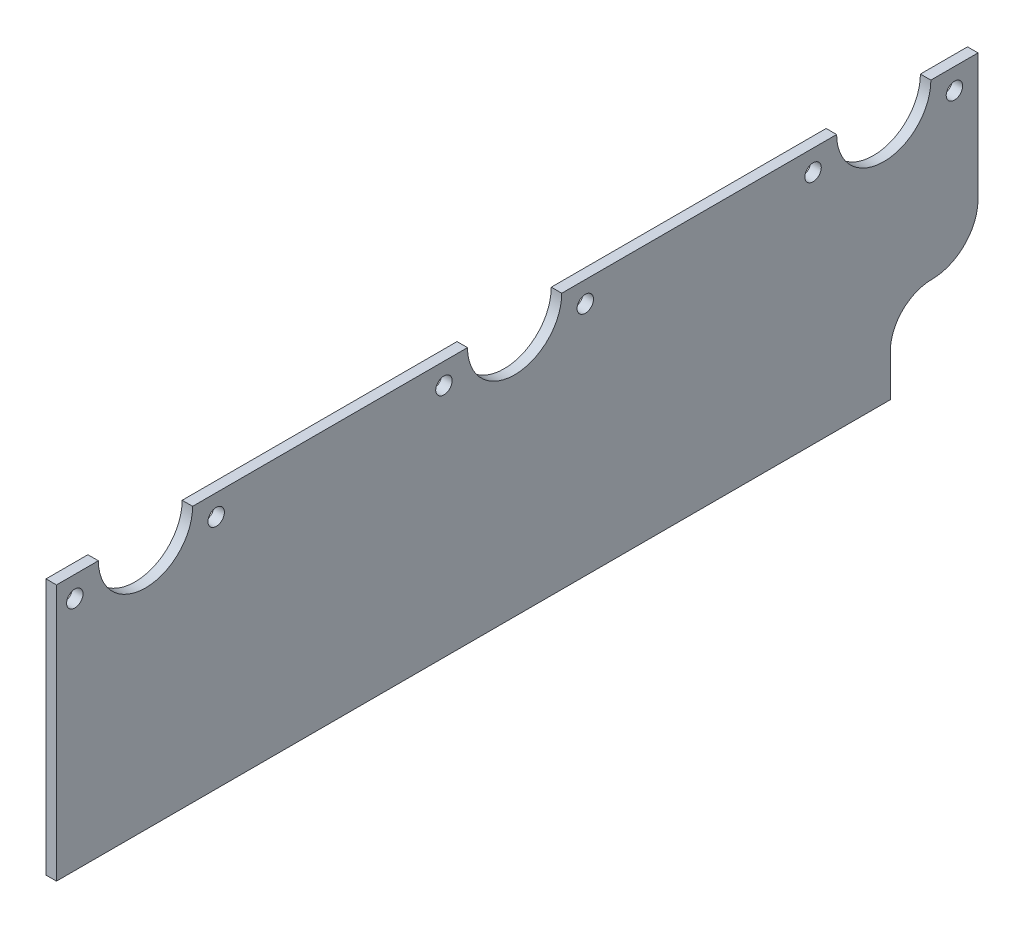
from build123d import *

# Parameters (mm, degrees)
BOSS_EXTRUDE1_DEPTH    = 3.175
F_10_CLEARANCE_HOLE1_D = 4.9784
CUT_EXTRUDE1_DEPTH     = 160.928314508


with BuildPart() as part:
    # Sketch1 → Boss-Extrude1 (new body)
    with BuildSketch(Plane(origin=(0, 0, 0), x_dir=(0, 0, -1), z_dir=(1, 0, 0))):
        with BuildLine():
            Line((139.7, 0), (-139.7, 0))
            Line((-139.7, 0), (-139.7, 77.7875))
            Line((-139.7, 77.7875), (-127, 77.7875))
            ThreePointArc((-127, 77.7875), (-112.7125, 63.5), (-98.425, 77.7875))
            Line((-98.425, 77.7875), (-15.08125, 77.7875))
            ThreePointArc((-15.08125, 77.7875), (-0.79375, 63.5), (13.49375, 77.7875))
            Line((13.49375, 77.7875), (96.8375, 77.7875))
            ThreePointArc((96.8375, 77.7875), (111.125, 63.5), (125.4125, 77.7875))
            Line((125.4125, 77.7875), (139.7, 77.7875))
            Line((139.7, 77.7875), (139.7, 0))
        make_face()
    extrude(amount=BOSS_EXTRUDE1_DEPTH)

    # #10 Clearance Hole1 (through all)
    with Locations(Plane(origin=(3.175, 0, 0), x_dir=(0, 0, -1), z_dir=(1, 0, 0))):
        with Locations((-134.14375, 71.4375), (-91.28125, 71.4375), (-22.225, 71.4375), (20.6375, 71.4375), (89.69375, 71.4375), (132.55625, 71.4375)):
            Hole(F_10_CLEARANCE_HOLE1_D / 2)

    # Sketch4 → Cut-Extrude1 (cut, through all)
    with BuildSketch(Plane.ZY):
        with BuildLine():
            Line((-113.1189, 12.7), (-113.1189, 0))
            Line((-113.1189, 0), (-139.7, 0))
            Line((-139.7, 0), (-139.7, 38.89375))
            ThreePointArc((-139.7, 38.89375), (-135.465913951, 29.268268394), (-125.723317526, 25.31109823))
            ThreePointArc((-125.723317526, 25.31109823), (-116.810243373, 21.615031404), (-113.1189, 12.7))
        make_face()
    extrude(amount=-CUT_EXTRUDE1_DEPTH, mode=Mode.SUBTRACT)


solid = part.part
